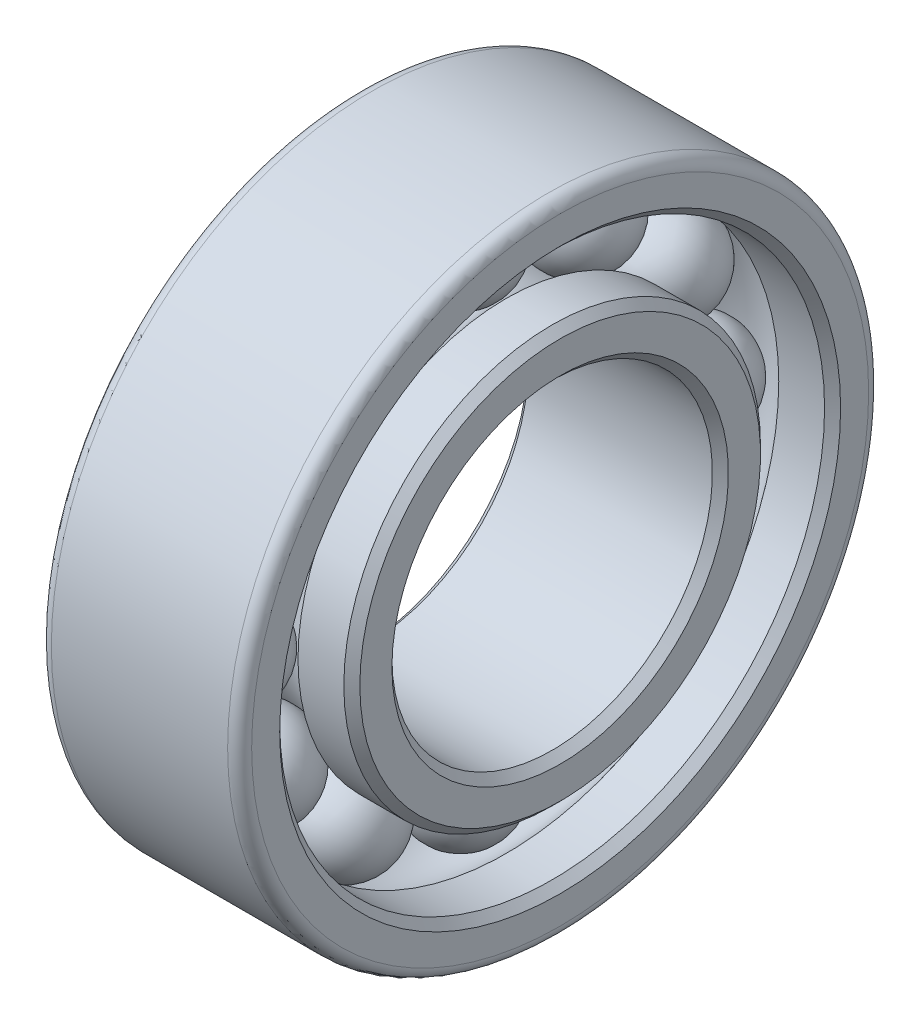
from build123d import *

# Parameters (mm, degrees)
PATTERN_CIRCULAR_5_COUNT = 12
FILLET_1_R               = 0.3
CHAMFER_1_SIZE           = 0.2
CHAMFER_2_SIZE           = 0.2


with BuildPart() as part:
    # Эскиз1 → Повернуть1 (revolve)
    with BuildSketch(Plane.XY, mode=Mode.PRIVATE) as revolve_1_sk:
        with BuildLine():
            Line((0, 0), (5, 0))
            Line((5, 0), (5, 1.2))
            Line((5, 1.2), (3.656369585, 1.2))
            ThreePointArc((3.656369585, 1.2), (2.510622896, 0.602596882), (1.364876207, 1.2))
            Line((1.364876207, 1.2), (0, 1.2))
            Line((0, 1.2), (0, 0))
        make_face()
        with BuildLine():
            Line((0, 2.8), (1.364876207, 2.8))
            ThreePointArc((1.364876207, 2.8), (2.510622896, 3.397403118), (3.656369585, 2.8))
            Line((3.656369585, 2.8), (5, 2.8))
            Line((5, 2.8), (5, 4))
            Line((5, 4), (0, 4))
            Line((0, 4), (0, 2.8))
        make_face()
    revolve(revolve_1_sk.sketch.rotate(Axis((-1.066901408, -4, 0), (1, 0, 0)), 90), axis=Axis((-1.066901408, -4, 0), (1, 0, 0)))

    # Скругление1
    fillet_1_edges = [part.edges().sort_by_distance(p)[0] for p in [
        (0, -4, -8),
        (5, -4, -8),
    ]]
    fillet(fillet_1_edges, radius=FILLET_1_R)

    # Фаска1
    chamfer_1_edges = [part.edges().sort_by_distance(p)[0] for p in [
        (0, -4, -5.2),
        (5, -4, -5.2),
        (5, -4, -4),
        (0, -4, -4),
    ]]
    chamfer(chamfer_1_edges, length=CHAMFER_1_SIZE)

    # Фаска2
    chamfer_2_edges = [part.edges().sort_by_distance(p)[0] for p in [
        (5, -4, -6.8),
        (0, -4, -6.8),
    ]]
    chamfer(chamfer_2_edges, length=CHAMFER_2_SIZE)


with BuildPart() as body_2:
    # Эскиз2 → Повернуть2 (revolve)
    with BuildSketch(Plane.XY):
        with BuildLine():
            Line((2.510622896, 3.102596882), (2.510622896, 0.602596882))
            ThreePointArc((2.510622896, 0.602596882), (1.260622896, 1.852596882), (2.510622896, 3.102596882))
        make_face()
    revolve(axis=Axis((2.510622896, 3.102596882, 0), (0, -1, 0)))


with BuildPart() as pattern_circular_5_1:
    # Круговой массив5: pattern copy
    add(body_2.part.rotate(Axis((0, -4, 0), (1, 0, 0)), 1 * 360 / PATTERN_CIRCULAR_5_COUNT))


with BuildPart() as pattern_circular_5_2:
    # Круговой массив5: pattern copy
    add(body_2.part.rotate(Axis((0, -4, 0), (1, 0, 0)), 2 * 360 / PATTERN_CIRCULAR_5_COUNT))


with BuildPart() as pattern_circular_5_3:
    # Круговой массив5: pattern copy
    add(body_2.part.rotate(Axis((0, -4, 0), (1, 0, 0)), 3 * 360 / PATTERN_CIRCULAR_5_COUNT))


with BuildPart() as pattern_circular_5_4:
    # Круговой массив5: pattern copy
    add(body_2.part.rotate(Axis((0, -4, 0), (1, 0, 0)), 4 * 360 / PATTERN_CIRCULAR_5_COUNT))


with BuildPart() as pattern_circular_5_5:
    # Круговой массив5: pattern copy
    add(body_2.part.rotate(Axis((0, -4, 0), (1, 0, 0)), 5 * 360 / PATTERN_CIRCULAR_5_COUNT))


with BuildPart() as pattern_circular_5_6:
    # Круговой массив5: pattern copy
    add(body_2.part.rotate(Axis((0, -4, 0), (1, 0, 0)), 6 * 360 / PATTERN_CIRCULAR_5_COUNT))


with BuildPart() as pattern_circular_5_7:
    # Круговой массив5: pattern copy
    add(body_2.part.rotate(Axis((0, -4, 0), (1, 0, 0)), 7 * 360 / PATTERN_CIRCULAR_5_COUNT))


with BuildPart() as pattern_circular_5_8:
    # Круговой массив5: pattern copy
    add(body_2.part.rotate(Axis((0, -4, 0), (1, 0, 0)), 8 * 360 / PATTERN_CIRCULAR_5_COUNT))


with BuildPart() as pattern_circular_5_9:
    # Круговой массив5: pattern copy
    add(body_2.part.rotate(Axis((0, -4, 0), (1, 0, 0)), 9 * 360 / PATTERN_CIRCULAR_5_COUNT))


with BuildPart() as pattern_circular_5_10:
    # Круговой массив5: pattern copy
    add(body_2.part.rotate(Axis((0, -4, 0), (1, 0, 0)), 10 * 360 / PATTERN_CIRCULAR_5_COUNT))


with BuildPart() as pattern_circular_5_11:
    # Круговой массив5: pattern copy
    add(body_2.part.rotate(Axis((0, -4, 0), (1, 0, 0)), 11 * 360 / PATTERN_CIRCULAR_5_COUNT))


solid = Compound([part.part, body_2.part, pattern_circular_5_1.part, pattern_circular_5_2.part, pattern_circular_5_3.part, pattern_circular_5_4.part, pattern_circular_5_5.part, pattern_circular_5_6.part, pattern_circular_5_7.part, pattern_circular_5_8.part, pattern_circular_5_9.part, pattern_circular_5_10.part, pattern_circular_5_11.part])
